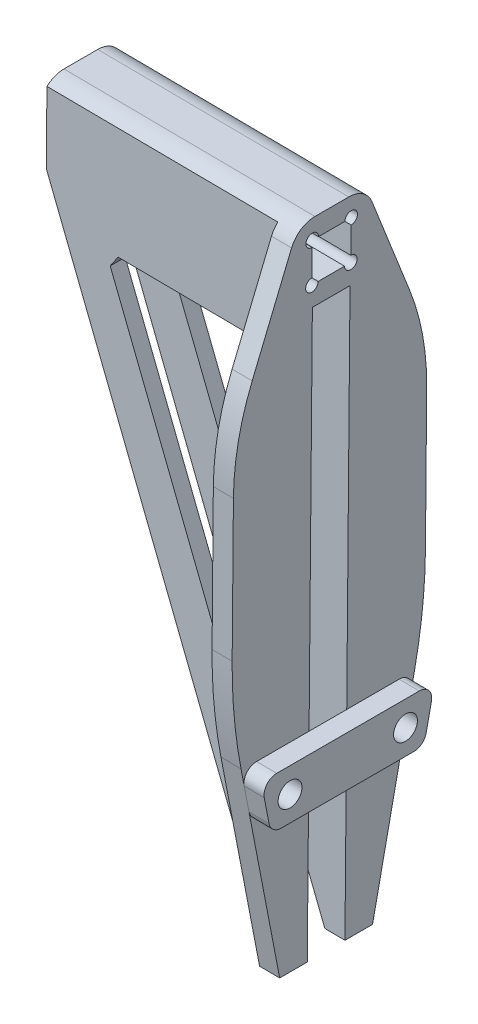
from build123d import *

# Parameters (mm, degrees)
BOSS_EXTRUDE1_DEPTH      = 1.5
BOSS_EXTRUDE2_DEPTH      = 2.7
BOSS_EXTRUDE2_DEPTH_BACK = 2.7
CUT_EXTRUDE1_DEPTH       = 1.5
BOSS_EXTRUDE3_DEPTH      = 1.6
CUT_EXTRUDE2_DEPTH       = 173.771231485
CUT_EXTRUDE2_DEPTH_BACK  = 173.771231485
CUT_EXTRUDE3_DEPTH       = 1.5
SKETCH9_W                = 3.1
SKETCH9_H                = 3.1
SKETCH9_W_2              = 3
SKETCH9_H_2              = 3
CUT_EXTRUDE4_DEPTH       = 38.081608425
SKETCH10_R               = 0.5
CUT_EXTRUDE5_DEPTH       = 38.081608425
CUT_EXTRUDE6_DEPTH       = 38.081608425
FILLET1_R                = 20
CUT_EXTRUDE7_DEPTH       = 38.081608425
FILLET2_R                = 40
SKETCH14_R               = 0.95
SKETCH14_W               = 1.2
SKETCH14_H               = 4
SKETCH14_W_2             = 3
BOSS_EXTRUDE4_DEPTH      = 1.6
SKETCH15_R               = 0.95
CUT_EXTRUDE8_DEPTH       = 38.081608425
FILLET3_R                = 1
CUT_EXTRUDE9_DEPTH       = 173.374562434
CUT_EXTRUDE9_DEPTH_BACK  = 173.374562434
CHAMFER1_SIZE            = 1


with BuildPart() as part:
    # Sketch3 → Boss-Extrude1 (new, symmetric)
    with BuildSketch(Plane.XY):
        Polygon((-149.213067775, 29.954800958), (-159.212671499, 30.043825512), (-159.65781191, -19.956174488), (-149.658208186, -20.045199042), align=None)
        Polygon((-159.65781191, -19.956174488), (-159.212671499, 30.043825512), (-169.212275222, 30.132850067), (-169.657415633, -19.867149933), align=None)
        Polygon((-149.198823847, 31.554737554), (-169.198031294, 31.732786662), (-169.212275222, 30.132850067), (-149.213067775, 29.954800958), align=None)
    extrude(amount=BOSS_EXTRUDE1_DEPTH, both=True)

    # Sketch4 → Boss-Extrude2 (add, two sides: drawn at the far end of the back side and taken through both)
    with BuildSketch(Plane.XY.offset(-BOSS_EXTRUDE2_DEPTH_BACK)):
        Polygon((-149.213067775, 29.954800958), (-159.212671499, 30.043825512), (-159.65781191, -19.956174488), (-149.658208186, -20.045199042), align=None)
        Polygon((-159.212671499, 30.043825512), (-169.212275222, 30.132850067), (-169.657415633, -19.867149933), (-159.65781191, -19.956174488), align=None)
        Polygon((-149.198823847, 31.554737554), (-169.198031294, 31.732786662), (-169.212275222, 30.132850067), (-149.213067775, 29.954800958), align=None)
    extrude(amount=BOSS_EXTRUDE2_DEPTH + BOSS_EXTRUDE2_DEPTH_BACK)

    # Sketch5 → Cut-Extrude1 (cut, symmetric)
    with BuildSketch(Plane.XY):
        Polygon((-149.658208186, -20.045199042), (-149.254241632, 25.329984236), (-169.253449079, 25.508033344), (-169.657415633, -19.867149933), align=None)
    extrude(amount=CUT_EXTRUDE1_DEPTH, both=True, mode=Mode.SUBTRACT)

    # Sketch6 → Boss-Extrude3 (add)
    with BuildSketch(Plane(origin=(-149.467902798, 1.330684074, 0), x_dir=(0, 0, -1), z_dir=(0.999960372358546, -0.00890245542299091, 0))):
        Polygon((-2.7, 30.225251236), (-2.7, -21.376730225), (-7.7, -21.376730225), (-7.7, 17.725251236), align=None)
        Polygon((2.7, -21.376730225), (2.7, 30.225251236), (7.7, 17.725251236), (7.7, -21.376730225), align=None)
    extrude(amount=-BOSS_EXTRUDE3_DEPTH)

    # Sketch7 → Cut-Extrude2 (cut, two sides: drawn at the far end of the back side and taken through both)
    with BuildSketch(Plane.XY.offset(-CUT_EXTRUDE2_DEPTH_BACK)):
        Polygon((-151.258144782, -20.030955113), (-169.253449079, 25.508033344), (-169.657415633, -19.867149933), align=None)
    extrude(amount=CUT_EXTRUDE2_DEPTH + CUT_EXTRUDE2_DEPTH_BACK, mode=Mode.SUBTRACT)

    # Sketch8 → Cut-Extrude3 (cut, symmetric)
    with BuildSketch(Plane.XY):
        Polygon((-371.727094297, 31.935800663), (-371.753801663, 28.935919545), (-39.244134182, 25.975649744), (-39.217426816, 28.975530862), align=None)
    extrude(amount=CUT_EXTRUDE3_DEPTH, both=True, mode=Mode.SUBTRACT)

    # Sketch9 → Cut-Extrude4 (cut, through all)
    with BuildSketch(Plane(origin=(-149.467902798, 1.330684074, 0), x_dir=(0, 0, -1), z_dir=(0.999960372358546, -0.00890245542299091, 0))):
        with Locations((0, 27.125251236)):
            Rectangle(SKETCH9_W, SKETCH9_H)
        with Locations((0, 27.125251236)):
            Rectangle(SKETCH9_W_2, SKETCH9_H_2, mode=Mode.SUBTRACT)
    extrude(amount=-CUT_EXTRUDE4_DEPTH, mode=Mode.SUBTRACT)

    # Sketch10 → Cut-Extrude5 (cut, through all)
    with BuildSketch(Plane(origin=(-149.467902798, 1.330684074, 0), x_dir=(0, 0, -1), z_dir=(0.999960372358546, -0.00890245542299091, 0))):
        with Locations((-1.55, 25.575251236)):
            Circle(SKETCH10_R)
        with Locations((1.55, 25.575251236)):
            Circle(SKETCH10_R)
        with Locations((-1.55, 28.675251236)):
            Circle(SKETCH10_R)
        with Locations((1.55, 28.675251236)):
            Circle(SKETCH10_R)
    extrude(amount=-CUT_EXTRUDE5_DEPTH, mode=Mode.SUBTRACT)

    # Sketch12 → Cut-Extrude6 (cut, through all)
    with BuildSketch(Plane(origin=(-149.467902798, 1.330684074, 0), x_dir=(0, 0, -1), z_dir=(0.999960372358546, -0.00890245542299091, 0))):
        with BuildLine():
            Line((-2.7, 30.225251236), (-3.202887459, 28.968032588))
            ThreePointArc((-3.202887459, 28.968032588), (-2.467191696, 29.881385696), (-1.345934077, 30.225251236))
            Line((-1.345934077, 30.225251236), (-2.7, 30.225251236))
        make_face()
        with BuildLine():
            ThreePointArc((1.345934077, 30.225251236), (2.467191696, 29.881385696), (3.202887459, 28.968032588))
            Line((3.202887459, 28.968032588), (2.7, 30.225251236))
            Line((2.7, 30.225251236), (1.345934077, 30.225251236))
        make_face()
    extrude(amount=-CUT_EXTRUDE6_DEPTH, mode=Mode.SUBTRACT)

    # Fillet1
    fillet1_edges = [part.edges().sort_by_distance(p)[0] for p in [
        (-150.110072837, 19.062354864, 7.7),
        (-150.110072837, 19.062354864, -7.7),
    ]]
    fillet(fillet1_edges, radius=FILLET1_R)

    # Sketch13 → Cut-Extrude7 (cut, through all)
    with BuildSketch(Plane(origin=(-149.467902798, 1.330684074, 0), x_dir=(0, 0, -1), z_dir=(0.999960372358546, -0.00890245542299091, 0))):
        Polygon((-7.7, -1.376730225), (-7.7, -21.376730225), (-3.7, -21.376730225), align=None)
        Polygon((7.7, -21.376730225), (7.7, -1.376730225), (3.7, -21.376730225), align=None)
    extrude(amount=-CUT_EXTRUDE7_DEPTH, mode=Mode.SUBTRACT)

    # Fillet2
    fillet2_edges = [part.edges().sort_by_distance(p)[0] for p in [
        (-150.280127376, -0.03886963, -7.7),
        (-150.280127376, -0.03886963, 7.7),
    ]]
    fillet(fillet2_edges, radius=FILLET2_R)

    # Sketch15 → Cut-Extrude8 (cut, through all)
    with BuildSketch(Plane(origin=(-149.467902798, 1.330684074, 0), x_dir=(0, 0, -1), z_dir=(0.999960372358546, -0.00890245542299091, 0))):
        with Locations(Location((-4.6, -7.376730225, 0), (0, 0, 90))):
            Circle(SKETCH15_R)
        with Locations(Location((4.6, -7.376730225, 0), (0, 0, 90))):
            Circle(SKETCH15_R)
    extrude(amount=-CUT_EXTRUDE8_DEPTH, mode=Mode.SUBTRACT)

    # Sketch16 → Cut-Extrude9 (cut, two sides: drawn at the far end of the back side and taken through both)
    with BuildSketch(Plane.XY.offset(-CUT_EXTRUDE9_DEPTH_BACK)):
        Polygon((-164.531480082, 22.265867746), (-152.747142701, -7.555623189), (-152.48260268, 22.158598902), align=None)
    extrude(amount=CUT_EXTRUDE9_DEPTH + CUT_EXTRUDE9_DEPTH_BACK, mode=Mode.SUBTRACT)

    # Chamfer1
    chamfer1_edges = [part.edges().sort_by_distance(p)[0] for p in [
        (-152.747142701, -7.555623189, -2.1),
        (-152.747142701, -7.555623189, 2.1),
        (-164.531480082, 22.265867746, -2.1),
        (-164.531480082, 22.265867746, 2.1),
        (-152.48260268, 22.158598902, -2.1),
        (-152.48260268, 22.158598902, 2.1),
    ]]
    chamfer(chamfer1_edges, length=CHAMFER1_SIZE)


with BuildPart() as body_2:
    # Sketch14 → Boss-Extrude4 (new body)
    # profile 1 of 5: a face of its own
    with BuildSketch(Plane(origin=(-149.467902798, 1.330684074, 0), x_dir=(0, 0, -1), z_dir=(0.999960372358546, -0.00890245542299091, 0))):
        Polygon((-2.7, -9.376730225), (-2.7, -5.376730225), (-6.9, -5.376730225), (-6.1, -9.376730225), align=None)
        with Locations(Location((-4.6, -7.376730225, 0), (0, 0, 90))):
            Circle(SKETCH14_R, mode=Mode.SUBTRACT)
    # profile 2 of 5: a face of its own
    with BuildSketch(Plane(origin=(-149.467902798, 1.330684074, 0), x_dir=(0, 0, -1), z_dir=(0.999960372358546, -0.00890245542299091, 0))):
        with Locations((-2.1, -7.376730225)):
            Rectangle(SKETCH14_W, SKETCH14_H)
    # profile 3 of 5: a face of its own
    with BuildSketch(Plane(origin=(-149.467902798, 1.330684074, 0), x_dir=(0, 0, -1), z_dir=(0.999960372358546, -0.00890245542299091, 0))):
        with Locations((0, -7.376730225)):
            Rectangle(SKETCH14_W_2, SKETCH14_H)
    # profile 4 of 5: a face of its own
    with BuildSketch(Plane(origin=(-149.467902798, 1.330684074, 0), x_dir=(0, 0, -1), z_dir=(0.999960372358546, -0.00890245542299091, 0))):
        with Locations((2.1, -7.376730225)):
            Rectangle(SKETCH14_W, SKETCH14_H)
    # profile 5 of 5: a face of its own
    with BuildSketch(Plane(origin=(-149.467902798, 1.330684074, 0), x_dir=(0, 0, -1), z_dir=(0.999960372358546, -0.00890245542299091, 0))):
        Polygon((6.1, -9.376730225), (6.9, -5.376730225), (2.7, -5.376730225), (2.7, -9.376730225), align=None)
        with Locations(Location((4.6, -7.376730225, 0), (0, 0, 90))):
            Circle(SKETCH14_R, mode=Mode.SUBTRACT)
    extrude(amount=BOSS_EXTRUDE4_DEPTH)

    # Fillet3
    fillet3_edges = [body_2.edges().sort_by_distance(p)[0] for p in [
        (-148.715800602, -4.052955049, -6.9),
        (-148.751410423, -8.052796538, -6.1),
        (-148.751410423, -8.052796538, 6.1),
        (-148.715800602, -4.052955049, 6.9),
    ]]
    fillet(fillet3_edges, radius=FILLET3_R)


solid = Compound([part.part, body_2.part])
